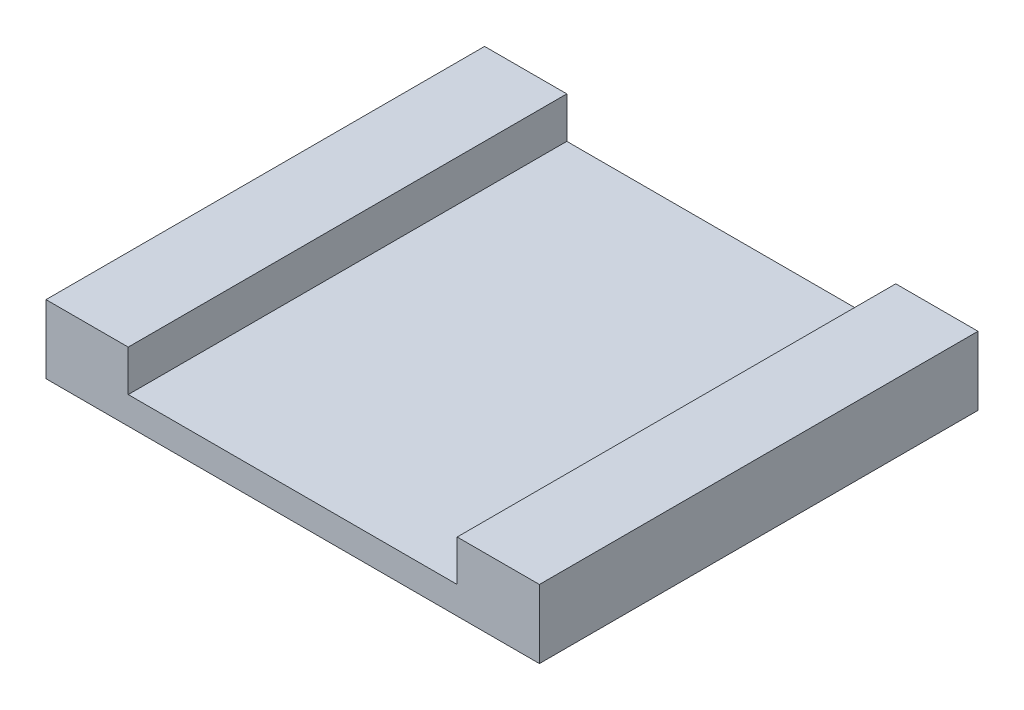
from build123d import *

# Parameters (mm, degrees)
BOSS_EXTRUDE1_DEPTH = 203.2


with BuildPart() as part:
    # Sketch1 → Boss-Extrude1 (new body)
    with BuildSketch(Plane.XY):
        Polygon((0, 0), (76.2, 0), (76.2, 19.05), (114.3, 19.05), (114.3, -12.7), (0, -12.7), align=None)
    boss_extrude1 = extrude(amount=-BOSS_EXTRUDE1_DEPTH)

    # Mirror1: Boss-Extrude1 across plane
    add(boss_extrude1.mirror(Plane(origin=(0, -12.7, -203.2), x_dir=(0, 0, 1), z_dir=(-1, 0, 0))))


solid = part.part
